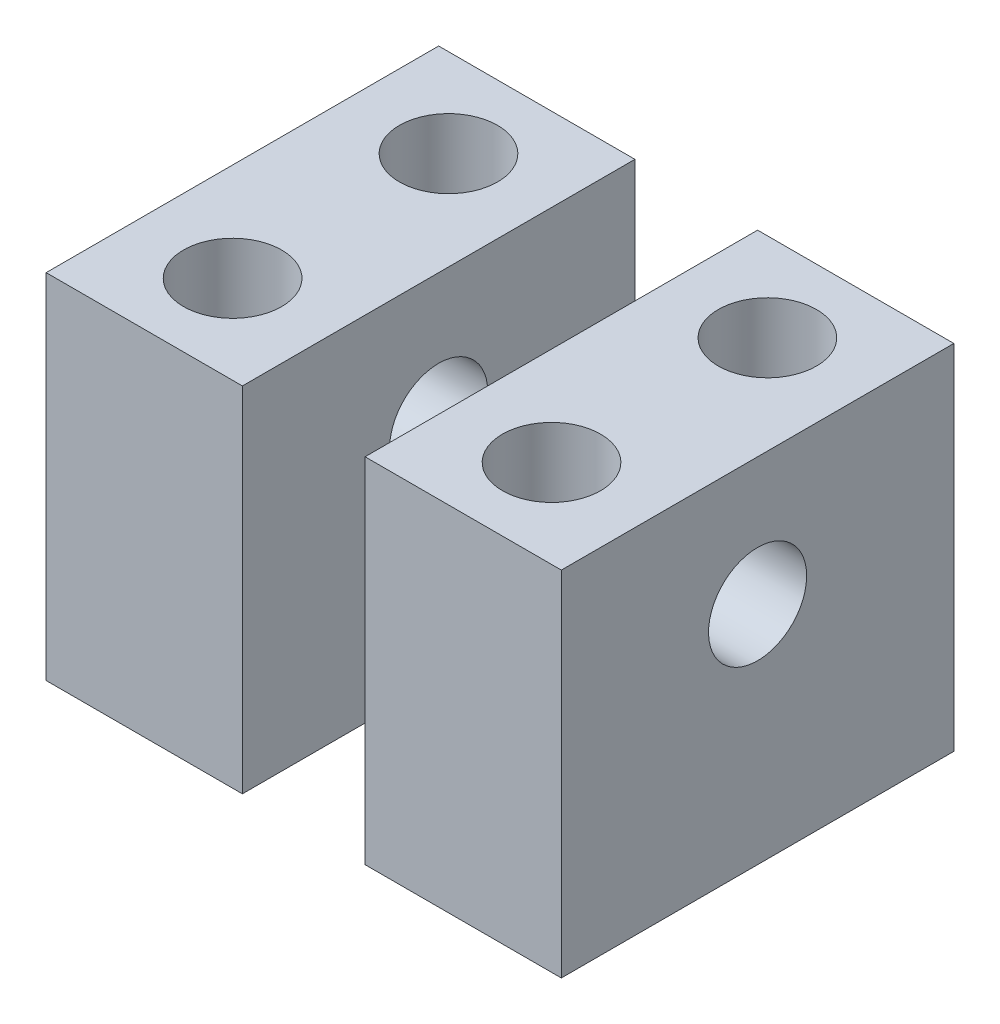
from build123d import *

# Parameters (mm, degrees)
BOSS_EXTRUDE1_DEPTH = 20
SKETCH3_R           = 2.5
CUT_EXTRUDE1_DEPTH  = 38.59072359
SKETCH4_R           = 2.5
CUT_EXTRUDE4_DEPTH  = 38.59072359
SKETCH5_W           = 6.25
SKETCH5_H           = 20
CUT_EXTRUDE5_DEPTH  = 37.25


with BuildPart() as part:
    # Sketch2 → Boss-Extrude1 (new body)
    with BuildSketch(Plane.XY):
        Polygon((0, 0), (0, 18), (10, 18), (10, 3), (16.25, 3), (16.25, 18), (26.25, 18), (26.25, 0), align=None)
    extrude(amount=BOSS_EXTRUDE1_DEPTH)

    # Sketch3 → Cut-Extrude1 (cut, through all)
    with BuildSketch(Plane(origin=(0, 18, 0), x_dir=(1, 0, 0), z_dir=(0, 1, 0))):
        with Locations(Location((21.25, -15.5, 0), (0, 0, 180))):
            Circle(SKETCH3_R)
        with Locations((21.25, -4.5)):
            Circle(SKETCH3_R)
        with Locations((5, -15.5)):
            Circle(SKETCH3_R)
        with Locations(Location((5, -4.5, 0), (0, 0, 180))):
            Circle(SKETCH3_R)
    extrude(amount=-CUT_EXTRUDE1_DEPTH, mode=Mode.SUBTRACT)

    # Sketch4 → Cut-Extrude4 (cut, through all)
    with BuildSketch(Plane(origin=(26.25, 0, 0), x_dir=(0, 0, -1), z_dir=(1, 0, 0))):
        with Locations(Location((-10, 11.5, 0), (0, 0, 90))):
            Circle(SKETCH4_R)
    extrude(amount=-CUT_EXTRUDE4_DEPTH, mode=Mode.SUBTRACT)

    # Sketch5 → Cut-Extrude5 (cut, through all)
    with BuildSketch(Plane(origin=(0, 3, 0), x_dir=(1, 0, 0), z_dir=(0, 1, 0))):
        with Locations((13.125, -10)):
            Rectangle(SKETCH5_W, SKETCH5_H)
    extrude(amount=-CUT_EXTRUDE5_DEPTH, mode=Mode.SUBTRACT)


with BuildPart() as cut_extrude5_piece_1:
    # of the separate pieces the step leaves, piece 1, a body of its own (cut_extrude5_pieces)
    add(part.part.solids().sort_by_distance((26.25, 0, 0))[0])


with BuildPart() as cut_extrude5_piece_2:
    # of the separate pieces the step leaves, piece 2, a body of its own (cut_extrude5_pieces)
    add(part.part.solids().sort_by_distance((0, 0, 0))[0])


solid = Compound([cut_extrude5_piece_1.part, cut_extrude5_piece_2.part])
